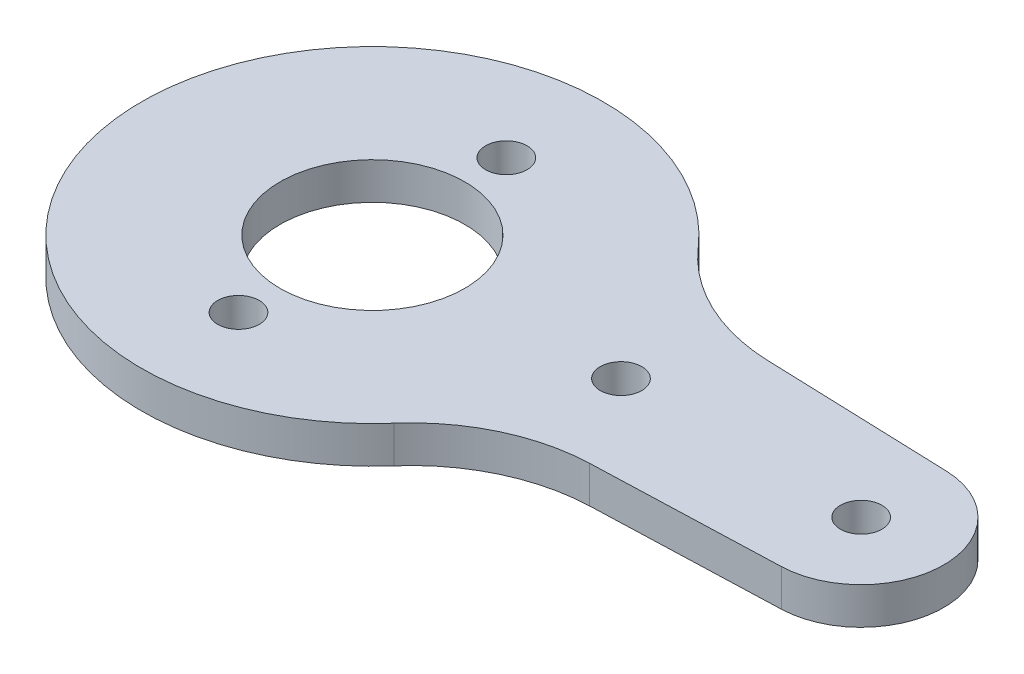
from build123d import *

# Parameters (mm, degrees)
BOSS_EXTRUDE1_DEPTH = 4
FILLET1_R           = 20
SKETCH1_R           = 10
SKETCH1_R_2         = 2.25
CUT_EXTRUDE3_DEPTH  = 131.855321132


with BuildPart() as part:
    # Sketch3 → Boss-Extrude1 (new body)
    with BuildSketch(Plane(origin=(0, 0, 0), x_dir=(1, 0, 0), z_dir=(0, 1, 0))):
        with BuildLine():
            Line((22.912878475, 10), (53.225121597, 8.941473145))
            ThreePointArc((53.225121597, 8.941473145), (61.859801844, 0), (53.225121597, -8.941473145))
            Line((53.225121597, -8.941473145), (22.912878475, -10))
            ThreePointArc((22.912878475, -10), (-25, 0), (22.912878475, 10))
        make_face()
    extrude(amount=BOSS_EXTRUDE1_DEPTH)

    # Fillet1
    fillet1_edges = [part.edges().sort_by_distance(p)[0] for p in [
        (22.912878475, 2, -10),
        (22.912878475, 2, 10),
    ]]
    fillet(fillet1_edges, radius=FILLET1_R)

    # Sketch1 → Cut-Extrude3 (cut, through all)
    with BuildSketch(Plane(origin=(103.38268991, 0, 0), x_dir=(1, 0, 0), z_dir=(0, 1, 0))):
        with Locations(Location((-103.38268991, 0, 0), (0, 0, 270))):
            Circle(SKETCH1_R)
        with Locations(Location((-103.38268991, 14.5, 0), (0, 0, 270))):
            Circle(SKETCH1_R_2)
        with Locations(Location((-76.469811435, 0, 0), (0, 0, 90))):
            Circle(SKETCH1_R_2)
        with Locations(Location((-50.469811435, 0, 0), (0, 0, 90))):
            Circle(SKETCH1_R_2)
        with Locations(Location((-103.38268991, -14.5, 0), (0, 0, 270))):
            Circle(SKETCH1_R_2)
    extrude(amount=CUT_EXTRUDE3_DEPTH, mode=Mode.SUBTRACT)


solid = part.part
